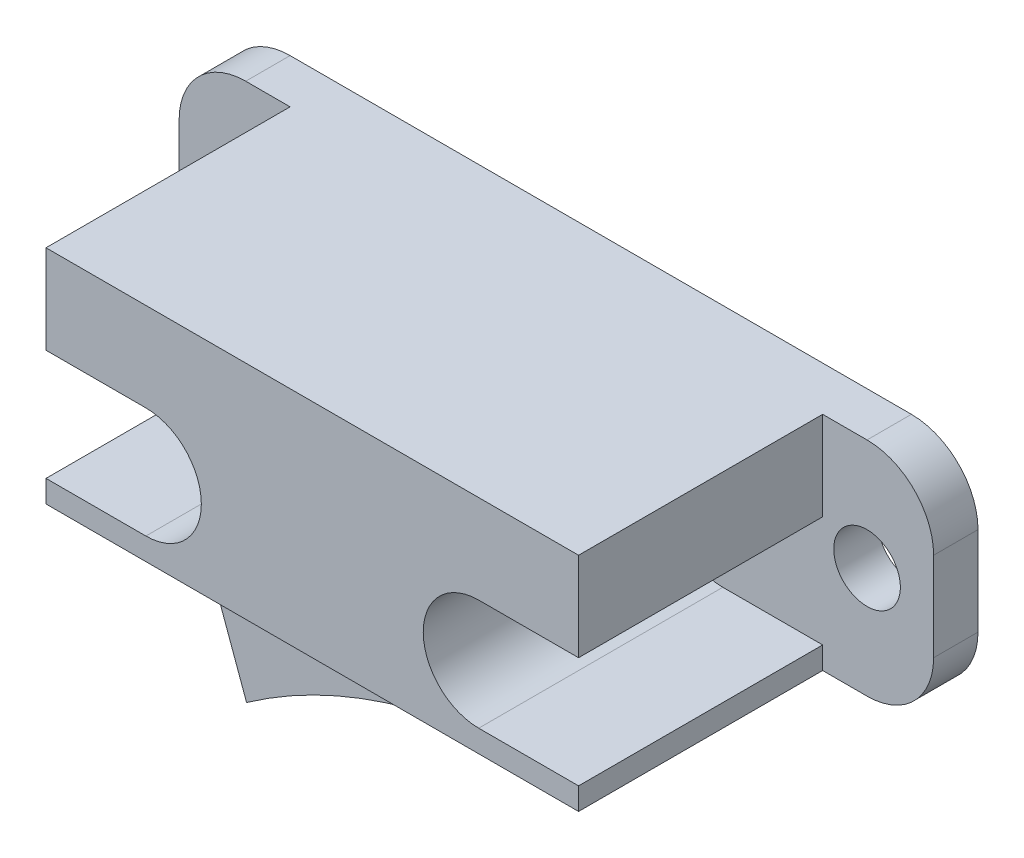
from build123d import *

# Parameters (mm, degrees)
SKETCH_1_W          = 34
SKETCH_1_H          = 10
EXTRUDE_1_DEPTH     = 2
FILLET_1_R          = 3
SKETCH_2_R          = 1.5
CUT_EXTRUDE_1_DEPTH = 2
EXTRUDE_2_DEPTH     = 11
SKETCH_5_W          = 21
SKETCH_5_H          = 14
EXTRUDE_4_DEPTH     = 2
EXTRUDE_4_TAPER     = 48
SKETCH_6_W          = 15
SKETCH_6_H          = 8
CUT_EXTRUDE_2_DEPTH = 0.3
EXTRUDE_5_DEPTH     = 8


with BuildPart() as part:
    # 草图1 → 凸台-拉伸1 (new body)
    with BuildSketch(Plane.XY):
        Rectangle(SKETCH_1_W, SKETCH_1_H)
    extrude(amount=EXTRUDE_1_DEPTH)

    # 圆角1
    fillet_1_edges = [part.edges().sort_by_distance(p)[0] for p in [
        (-17, 5, 1),
        (17, 5, 1),
        (17, -5, 1),
        (-17, -5, 1),
    ]]
    fillet(fillet_1_edges, radius=FILLET_1_R)

    # 草图2 → 切除-拉伸1 (cut)
    with BuildSketch(Plane.XY.offset(2)):
        with Locations((-14, 0)):
            Circle(SKETCH_2_R)
        with Locations(Location((14, 0, 0), (0, 0, 180))):
            Circle(SKETCH_2_R)
    extrude(amount=-CUT_EXTRUDE_1_DEPTH, mode=Mode.SUBTRACT)

    # 草图3 → 凸台-拉伸2 (add)
    with BuildSketch(Plane.XY.offset(2)):
        with BuildLine():
            Line((12, -5), (-12, -5))
            Line((-12, -5), (-12, -4))
            Line((-12, -4), (-7.5, -4))
            ThreePointArc((-7.5, -4), (-5, -1.5), (-7.5, 1))
            Line((-7.5, 1), (-12, 1))
            Line((-12, 1), (-12, 5))
            Line((-12, 5), (12, 5))
            Line((12, 5), (12, 1))
            Line((12, 1), (7.5, 1))
            ThreePointArc((7.5, 1), (5, -1.5), (7.5, -4))
            Line((7.5, -4), (12, -4))
            Line((12, -4), (12, -5))
        make_face()
    extrude(amount=EXTRUDE_2_DEPTH)

    # 草图5 → 凸台-拉伸4 (add)
    with BuildSketch(Plane.XZ.offset(5)):
        with Locations((0, 6)):
            Rectangle(SKETCH_5_W, SKETCH_5_H)
    extrude(amount=EXTRUDE_4_DEPTH, taper=EXTRUDE_4_TAPER)

    # 草图6 → 切除-拉伸2 (cut)
    with BuildSketch(Plane.XZ.offset(7)):
        with Locations((0, 6)):
            Rectangle(SKETCH_6_W, SKETCH_6_H)
    extrude(amount=-CUT_EXTRUDE_2_DEPTH, mode=Mode.SUBTRACT)

    # 草图8 → 凸台-拉伸5 (add)
    with BuildSketch(Plane.XY.offset(2)):
        with BuildLine():
            Line((7.5, -6.7), (7.5, -7))
            ThreePointArc((7.5, -7), (0.438935642, -8.061882235), (-5.960909355, -11.228616794))
            Line((-5.960909355, -11.228616794), (-7.5, -7))
            Line((-7.5, -7), (-7.5, -6.7))
            Line((-7.5, -6.7), (7.5, -6.7))
        make_face()
    extrude(amount=EXTRUDE_5_DEPTH)


solid = part.part
